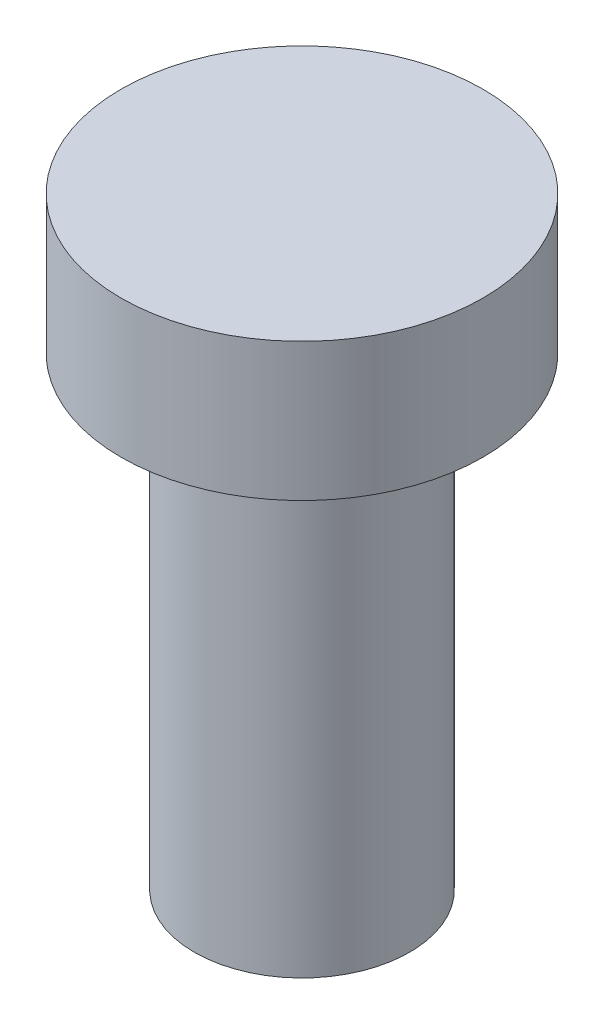
from build123d import *

# Parameters (mm, degrees)
ESQUISSE1_R        = 2.1
BOSS_EXTRU_1_DEPTH = 1.6
ESQUISSE2_R        = 1.25
BOSS_EXTRU_2_DEPTH = 5.4


with BuildPart() as part:
    # Esquisse1 → Boss.-Extru.1 (new body)
    with BuildSketch(Plane(origin=(0, 0, 0), x_dir=(1, 0, 0), z_dir=(0, 1, 0))):
        with Locations(Location((0, 0, 0), (0, 0, 270))):
            Circle(ESQUISSE1_R)
    extrude(amount=BOSS_EXTRU_1_DEPTH)

    # Esquisse2 → Boss.-Extru.2 (add)
    with BuildSketch(Plane.XZ):
        with Locations(Location((0, 0, 0), (0, 0, 90))):
            Circle(ESQUISSE2_R)
    extrude(amount=BOSS_EXTRU_2_DEPTH)


solid = part.part
